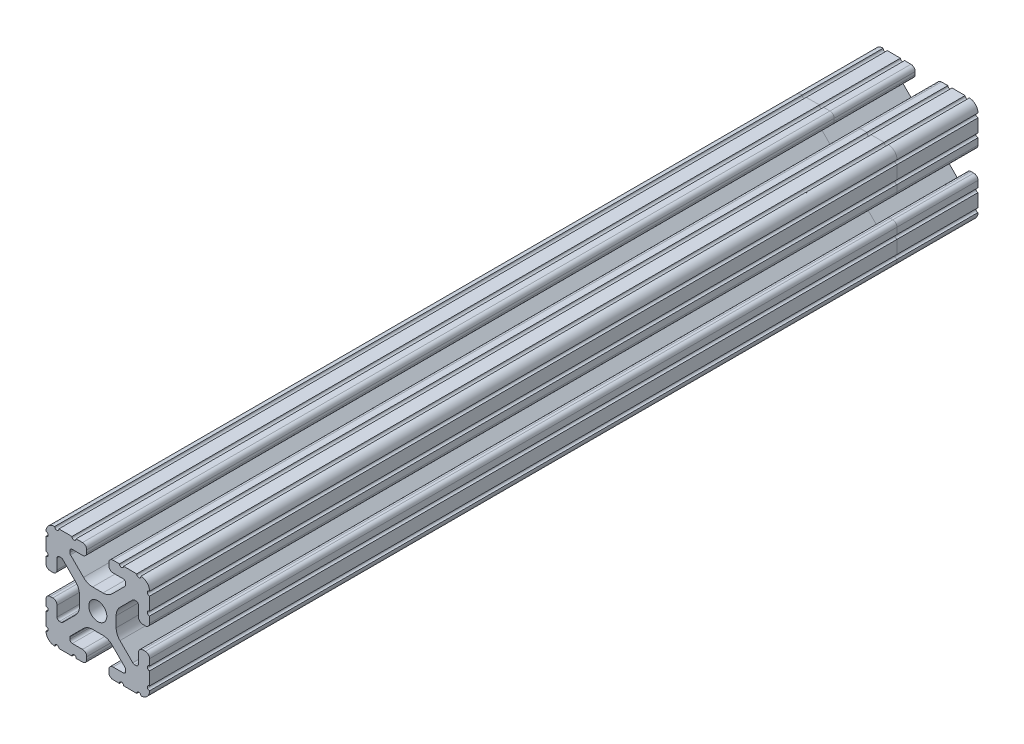
from build123d import *

# Parameters (mm, degrees)
SKETCH1_R = 3.3274


with BuildPart() as part:
    # Sweep4: sweep along a path in Sketch2
    with BuildLine(Plane(origin=(0, 0, 0), x_dir=(1, 0, 0), z_dir=(0, 1, 0))) as sweep4_path:
        Line((0, 304.8), (0, 275))
        Line((0, 275), (0, 0))
    # Sketch1 → Sweep4 (sweep)
    with BuildSketch(Plane(origin=(0, 0, -304.8), x_dir=(-1, 0, 0), z_dir=(0, 0, -1))):
        with BuildLine():
            Line((14.327719201, 19.050000003), (9.498178698, 19.050000003))
            ThreePointArc((9.498178698, 19.050000003), (8.736178698, 18.288000003), (7.974178698, 19.050000003))
            Line((7.974178698, 19.050000003), (5.61761756, 19.050000003))
            ThreePointArc((5.61761756, 19.050000003), (4.519044055, 18.594955959), (4.06400001, 17.496382454))
            Line((4.06400001, 17.496382454), (4.06400001, 16.539617563))
            ThreePointArc((4.06400001, 16.539617563), (4.519044055, 15.441044058), (5.61761756, 14.986000013))
            Line((5.61761756, 14.986000013), (9.38530001, 14.986000013))
            ThreePointArc((9.38530001, 14.986000013), (10.022898195, 14.721898198), (10.28700001, 14.084300013))
            Line((10.28700001, 14.084300013), (10.28700001, 13.552357144))
            ThreePointArc((10.28700001, 13.552357144), (10.218362397, 13.207292006), (10.022898979, 12.914759744))
            Line((10.022898979, 12.914759744), (5.252158118, 8.144007146))
            ThreePointArc((5.252158118, 8.144007146), (3.715177385, 7.117027402), (1.902183988, 6.756400013))
            Line((1.902183988, 6.756400013), (-1.902183965, 6.756400013))
            ThreePointArc((-1.902183965, 6.756400013), (-3.715177361, 7.117027401), (-5.252158094, 8.144007145))
            Line((-5.252158094, 8.144007145), (-10.022898959, 12.914759744))
            ThreePointArc((-10.022898959, 12.914759744), (-10.218362376, 13.207292006), (-10.28699999, 13.552357144))
            Line((-10.28699999, 13.552357144), (-10.28699999, 14.084300013))
            ThreePointArc((-10.28699999, 14.084300013), (-10.022898174, 14.721898198), (-9.38529999, 14.986000013))
            Line((-9.38529999, 14.986000013), (-5.617617539, 14.986000013))
            ThreePointArc((-5.617617539, 14.986000013), (-4.519044035, 15.441044058), (-4.06399999, 16.539617563))
            Line((-4.06399999, 16.539617563), (-4.06399999, 17.496382454))
            ThreePointArc((-4.06399999, 17.496382454), (-4.519044035, 18.594955959), (-5.617617539, 19.050000003))
            Line((-5.617617539, 19.050000003), (-7.974178709, 19.050000003))
            ThreePointArc((-7.974178709, 19.050000003), (-8.736178709, 18.288000003), (-9.498178709, 19.050000003))
            Line((-9.498178709, 19.050000003), (-14.327719212, 19.050000003))
            ThreePointArc((-14.327719212, 19.050000003), (-15.087603125, 18.231251135), (-15.847487045, 19.049999996))
            ThreePointArc((-15.847487045, 19.049999996), (-18.120176306, 18.120192065), (-19.050000001, 15.847509253))
            ThreePointArc((-19.050000001, 15.847509253), (-18.231251012, 15.087625373), (-19.049999993, 14.327741484))
            Line((-19.049999993, 14.327741484), (-19.049999993, 9.49609147))
            ThreePointArc((-19.049999993, 9.49609147), (-18.231250986, 8.736207564), (-19.049999993, 7.976323658))
            Line((-19.049999993, 7.976323658), (-19.049999993, 5.617617549))
            ThreePointArc((-19.049999993, 5.617617549), (-18.594955948, 4.519044045), (-17.496382444, 4.064))
            Line((-17.496382444, 4.064), (-16.539617542, 4.064))
            ThreePointArc((-16.539617542, 4.064), (-15.441044038, 4.519044045), (-14.985999993, 5.617617549))
            Line((-14.985999993, 5.617617549), (-14.985999993, 9.385342517))
            ThreePointArc((-14.985999993, 9.385342517), (-14.721898178, 10.022940702), (-14.084299993, 10.287042517))
            Line((-14.084299993, 10.287042517), (-13.516042079, 10.287042517))
            ThreePointArc((-13.516042079, 10.287042517), (-13.170975915, 10.218404479), (-12.87844311, 10.022939917))
            Line((-12.87844311, 10.022939917), (-8.147580073, 5.292065242))
            ThreePointArc((-8.147580073, 5.292065242), (-7.117955872, 3.751120652), (-6.756399993, 1.933453584))
            Line((-6.756399993, 1.933453584), (-6.756399993, -1.933453584))
            ThreePointArc((-6.756399993, -1.933453584), (-7.117955872, -3.751120652), (-8.147580073, -5.292065242))
            Line((-8.147580073, -5.292065242), (-12.87844311, -10.022939917))
            ThreePointArc((-12.87844311, -10.022939917), (-13.170975915, -10.218404479), (-13.516042079, -10.287042517))
            Line((-13.516042079, -10.287042517), (-14.084299993, -10.287042517))
            ThreePointArc((-14.084299993, -10.287042517), (-14.721898178, -10.022940702), (-14.985999993, -9.385342517))
            Line((-14.985999993, -9.385342517), (-14.985999993, -5.617617549))
            ThreePointArc((-14.985999993, -5.617617549), (-15.441044038, -4.519044045), (-16.539617542, -4.064))
            Line((-16.539617542, -4.064), (-17.496382444, -4.064))
            ThreePointArc((-17.496382444, -4.064), (-18.594955948, -4.519044045), (-19.049999993, -5.617617549))
            Line((-19.049999993, -5.617617549), (-19.049999993, -7.97631849))
            ThreePointArc((-19.049999993, -7.97631849), (-18.231250986, -8.736202396), (-19.049999993, -9.496086301))
            Line((-19.049999993, -9.496086301), (-19.049999993, -14.327742909))
            ThreePointArc((-19.049999993, -14.327742909), (-18.231250983, -15.08762681), (-19.049999984, -15.847510721))
            ThreePointArc((-19.049999984, -15.847510721), (-18.120175688, -18.120192657), (-15.847486815, -19.049999997))
            ThreePointArc((-15.847486815, -19.049999997), (-15.087602925, -18.231251148), (-14.327719025, -19.049999987))
            Line((-14.327719025, -19.049999987), (-9.496062438, -19.049999987))
            ThreePointArc((-9.496062438, -19.049999987), (-8.736178522, -18.231251122), (-7.976294605, -19.049999987))
            Line((-7.976294605, -19.049999987), (-5.617617539, -19.049999987))
            ThreePointArc((-5.617617539, -19.049999987), (-4.519044035, -18.594955942), (-4.06399999, -17.496382437))
            Line((-4.06399999, -17.496382437), (-4.06399999, -16.539617536))
            ThreePointArc((-4.06399999, -16.539617536), (-4.519044035, -15.441044031), (-5.617617539, -14.985999987))
            Line((-5.617617539, -14.985999987), (-9.38529999, -14.985999987))
            ThreePointArc((-9.38529999, -14.985999987), (-10.022898174, -14.721898171), (-10.28699999, -14.084299987))
            Line((-10.28699999, -14.084299987), (-10.28699999, -13.552357118))
            ThreePointArc((-10.28699999, -13.552357118), (-10.218362376, -13.207291979), (-10.022898959, -12.914759717))
            Line((-10.022898959, -12.914759717), (-5.252158094, -8.144007118))
            ThreePointArc((-5.252158094, -8.144007118), (-3.715177361, -7.117027375), (-1.902183965, -6.756399987))
            Line((-1.902183965, -6.756399987), (1.902183988, -6.756399987))
            ThreePointArc((1.902183988, -6.756399987), (3.715177385, -7.117027375), (5.252158118, -8.144007119))
            Line((5.252158118, -8.144007119), (10.022898979, -12.914759717))
            ThreePointArc((10.022898979, -12.914759717), (10.218362397, -13.207291979), (10.28700001, -13.552357118))
            Line((10.28700001, -13.552357118), (10.28700001, -14.084299987))
            ThreePointArc((10.28700001, -14.084299987), (10.022898195, -14.721898171), (9.38530001, -14.985999987))
            Line((9.38530001, -14.985999987), (5.61761756, -14.985999987))
            ThreePointArc((5.61761756, -14.985999987), (4.519044055, -15.441044031), (4.06400001, -16.539617536))
            Line((4.06400001, -16.539617536), (4.06400001, -17.496382437))
            ThreePointArc((4.06400001, -17.496382437), (4.519044055, -18.594955942), (5.61761756, -19.049999987))
            Line((5.61761756, -19.049999987), (7.976294626, -19.049999987))
            ThreePointArc((7.976294626, -19.049999987), (8.736178543, -18.231251122), (9.496062459, -19.049999987))
            Line((9.496062459, -19.049999987), (14.327719046, -19.049999987))
            ThreePointArc((14.327719046, -19.049999987), (15.087602959, -18.231251119), (15.847486878, -19.04999998))
            ThreePointArc((15.847486878, -19.04999998), (18.12017574, -18.120192611), (19.050000007, -15.847510662))
            ThreePointArc((19.050000007, -15.847510662), (18.231250911, -15.087626785), (19.050000007, -14.327742909))
            Line((19.050000007, -14.327742909), (19.050000007, -9.496086301))
            ThreePointArc((19.050000007, -9.496086301), (18.231251003, -8.736202395), (19.050000007, -7.976318489))
            Line((19.050000007, -7.976318489), (19.050000007, -5.617617549))
            ThreePointArc((19.050000007, -5.617617549), (18.594955962, -4.519044045), (17.496382458, -4.064))
            Line((17.496382458, -4.064), (16.539617556, -4.064))
            ThreePointArc((16.539617556, -4.064), (15.441044052, -4.519044045), (14.986000007, -5.617617549))
            Line((14.986000007, -5.617617549), (14.986000007, -9.385342517))
            ThreePointArc((14.986000007, -9.385342517), (14.721898191, -10.022940702), (14.084300007, -10.287042517))
            Line((14.084300007, -10.287042517), (13.516042095, -10.287042517))
            ThreePointArc((13.516042095, -10.287042517), (13.170975932, -10.218404479), (12.878443126, -10.022939918))
            Line((12.878443126, -10.022939918), (8.147580087, -5.292065243))
            ThreePointArc((8.147580087, -5.292065243), (7.117955886, -3.751120653), (6.756400007, -1.933453584))
            Line((6.756400007, -1.933453584), (6.756400007, 1.933453584))
            ThreePointArc((6.756400007, 1.933453584), (7.117955886, 3.751120653), (8.147580087, 5.292065243))
            Line((8.147580087, 5.292065243), (12.878443126, 10.022939918))
            ThreePointArc((12.878443126, 10.022939918), (13.170975932, 10.218404479), (13.516042095, 10.287042517))
            Line((13.516042095, 10.287042517), (14.084300007, 10.287042517))
            ThreePointArc((14.084300007, 10.287042517), (14.721898191, 10.022940702), (14.986000007, 9.385342517))
            Line((14.986000007, 9.385342517), (14.986000007, 5.617617549))
            ThreePointArc((14.986000007, 5.617617549), (15.441044052, 4.519044045), (16.539617556, 4.064))
            Line((16.539617556, 4.064), (17.496382458, 4.064))
            ThreePointArc((17.496382458, 4.064), (18.594955962, 4.519044045), (19.050000007, 5.617617549))
            Line((19.050000007, 5.617617549), (19.050000007, 7.976323659))
            ThreePointArc((19.050000007, 7.976323659), (18.231251003, 8.736207565), (19.050000007, 9.496091471))
            Line((19.050000007, 9.496091471), (19.050000007, 14.327741484))
            ThreePointArc((19.050000007, 14.327741484), (18.231251061, 15.087625385), (19.049999988, 15.847509306))
            ThreePointArc((19.049999988, 15.847509306), (18.120176278, 18.120192088), (15.847487034, 19.050000003))
            ThreePointArc((15.847487034, 19.050000003), (15.087603117, 18.231251142), (14.327719201, 19.050000003))
        make_face()
        Circle(SKETCH1_R, mode=Mode.SUBTRACT)
    sweep(path=sweep4_path.line)


solid = part.part
